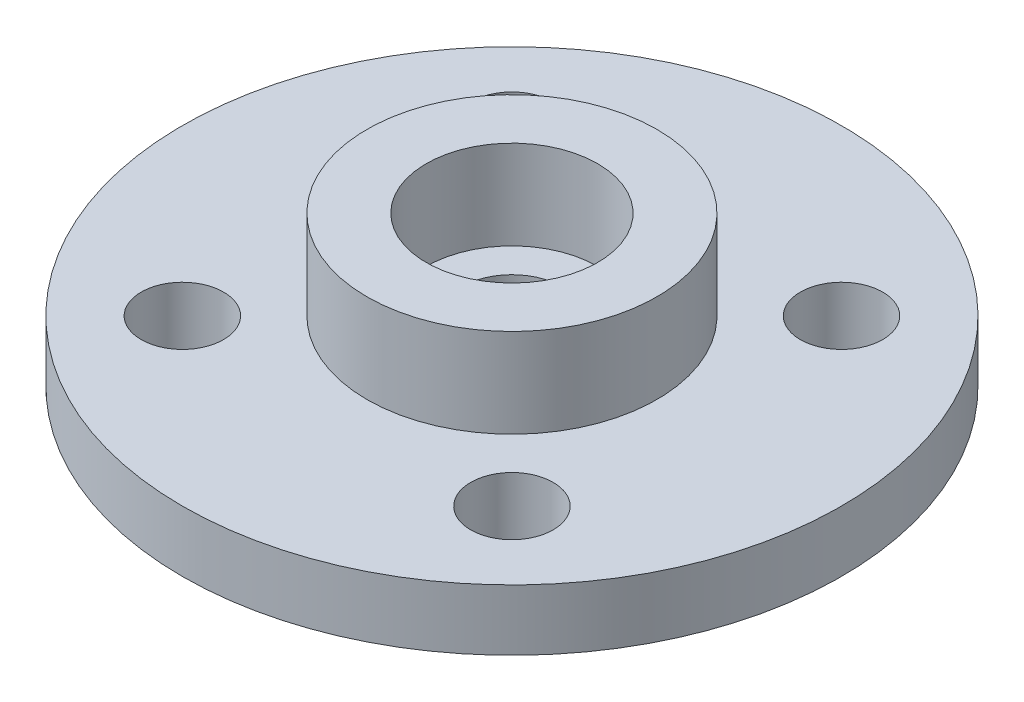
from build123d import *

# Parameters (mm, degrees)
SKETCH1_R           = 10
SKETCH1_R_2         = 1.53
SKETCH1_R_3         = 1.25
BOSS_EXTRUDE1_DEPTH = 1.85
SKETCH2_R           = 4.4
SKETCH2_R_2         = 2.6
BOSS_EXTRUDE2_DEPTH = 2.7


with BuildPart() as part:
    # Sketch1 → Boss-Extrude1 (new body)
    with BuildSketch(Plane(origin=(0, 0, 0), x_dir=(1, 0, 0), z_dir=(0, 1, 0))):
        with Locations(Location((0, 0, 0), (0, 0, 270))):
            Circle(SKETCH1_R)
        with Locations(Location((0, 0, 0), (0, 0, 270))):
            Circle(SKETCH1_R_2, mode=Mode.SUBTRACT)
        with Locations(Location((-5, 5, 0), (0, 0, 270))):
            Circle(SKETCH1_R_3, mode=Mode.SUBTRACT)
        with Locations(Location((5, 5, 0), (0, 0, 270))):
            Circle(SKETCH1_R_3, mode=Mode.SUBTRACT)
        with Locations(Location((5, -5, 0), (0, 0, 270))):
            Circle(SKETCH1_R_3, mode=Mode.SUBTRACT)
        with Locations(Location((-5, -5, 0), (0, 0, 270))):
            Circle(SKETCH1_R_3, mode=Mode.SUBTRACT)
    extrude(amount=BOSS_EXTRUDE1_DEPTH)

    # Sketch2 → Boss-Extrude2 (add)
    with BuildSketch(Plane(origin=(0, 1.85, 0), x_dir=(1, 0, 0), z_dir=(0, 1, 0))):
        with Locations(Location((0, 0, 0), (0, 0, 90))):
            Circle(SKETCH2_R)
        with Locations(Location((0, 0, 0), (0, 0, 90))):
            Circle(SKETCH2_R_2, mode=Mode.SUBTRACT)
    extrude(amount=BOSS_EXTRUDE2_DEPTH)


solid = part.part
